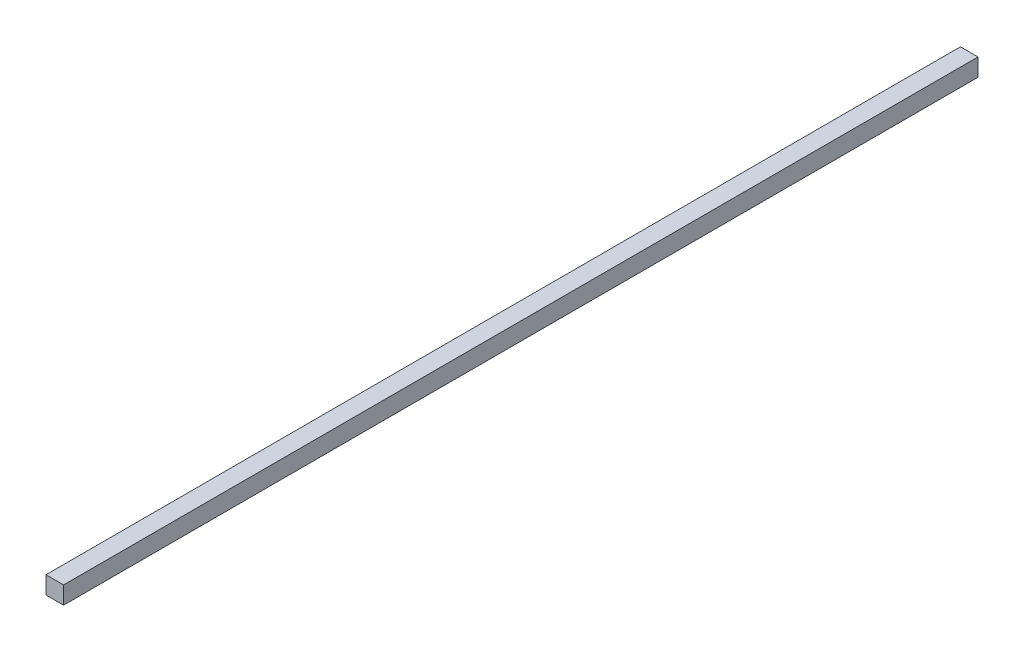
from build123d import *

# Parameters (mm, degrees)
SKETCH2_W           = 6.35
SKETCH2_H           = 330.2
BOSS_EXTRUDE1_DEPTH = 6.35


with BuildPart() as part:
    # Sketch2 → Boss-Extrude1 (new body)
    with BuildSketch(Plane(origin=(0, 0, 0), x_dir=(1, 0, 0), z_dir=(0, 1, 0))):
        with Locations((3.175, 165.1)):
            Rectangle(SKETCH2_W, SKETCH2_H)
    extrude(amount=BOSS_EXTRUDE1_DEPTH)


solid = part.part
